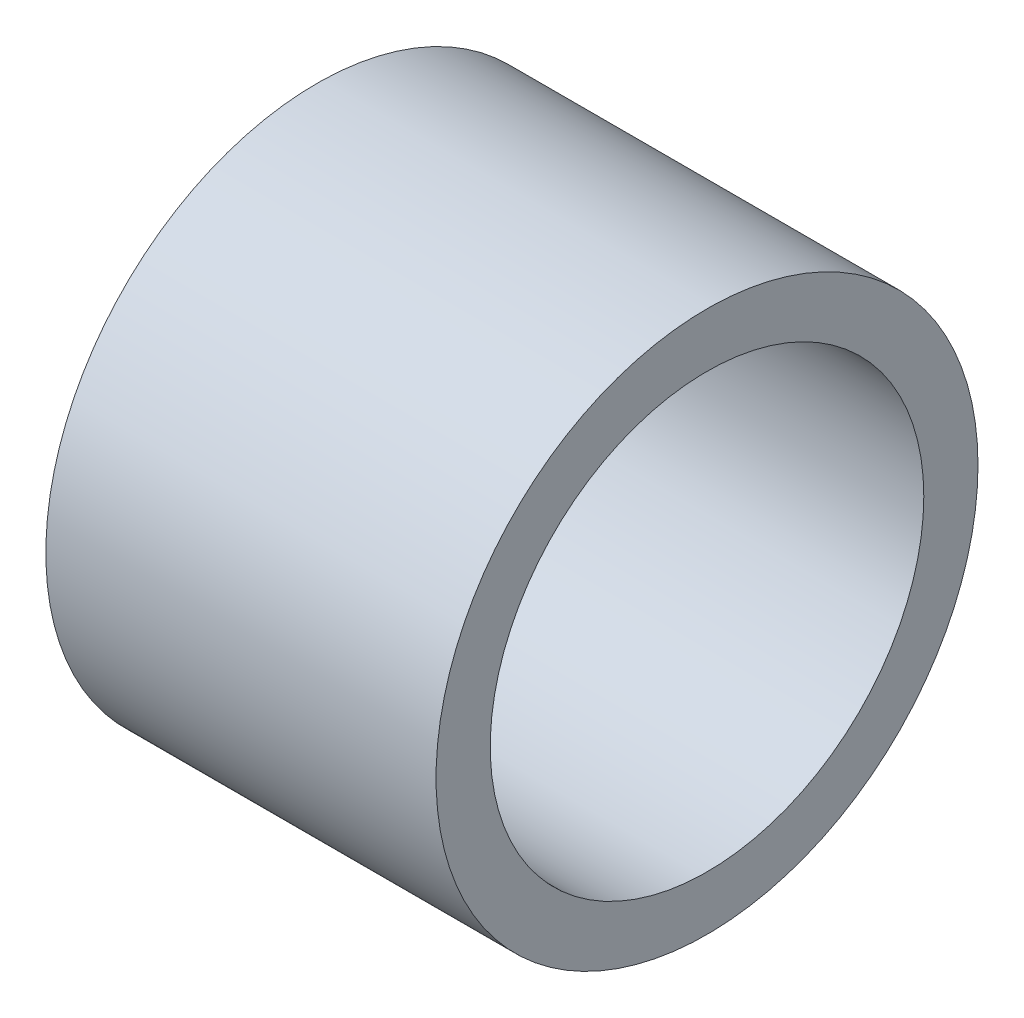
from build123d import *

# Parameters (mm, degrees)
SKETCH2_R           = 7.9375
SKETCH2_R_2         = 6.35
BOSS_EXTRUDE1_DEPTH = 11.43


with BuildPart() as part:
    # Sketch2 → Boss-Extrude1 (new body)
    with BuildSketch(Plane.YZ):
        with Locations(Location((0, 0, 0), (0, 0, 270))):
            Circle(SKETCH2_R)
        with Locations(Location((0, 0, 0), (0, 0, 270))):
            Circle(SKETCH2_R_2, mode=Mode.SUBTRACT)
    extrude(amount=BOSS_EXTRUDE1_DEPTH)


solid = part.part
